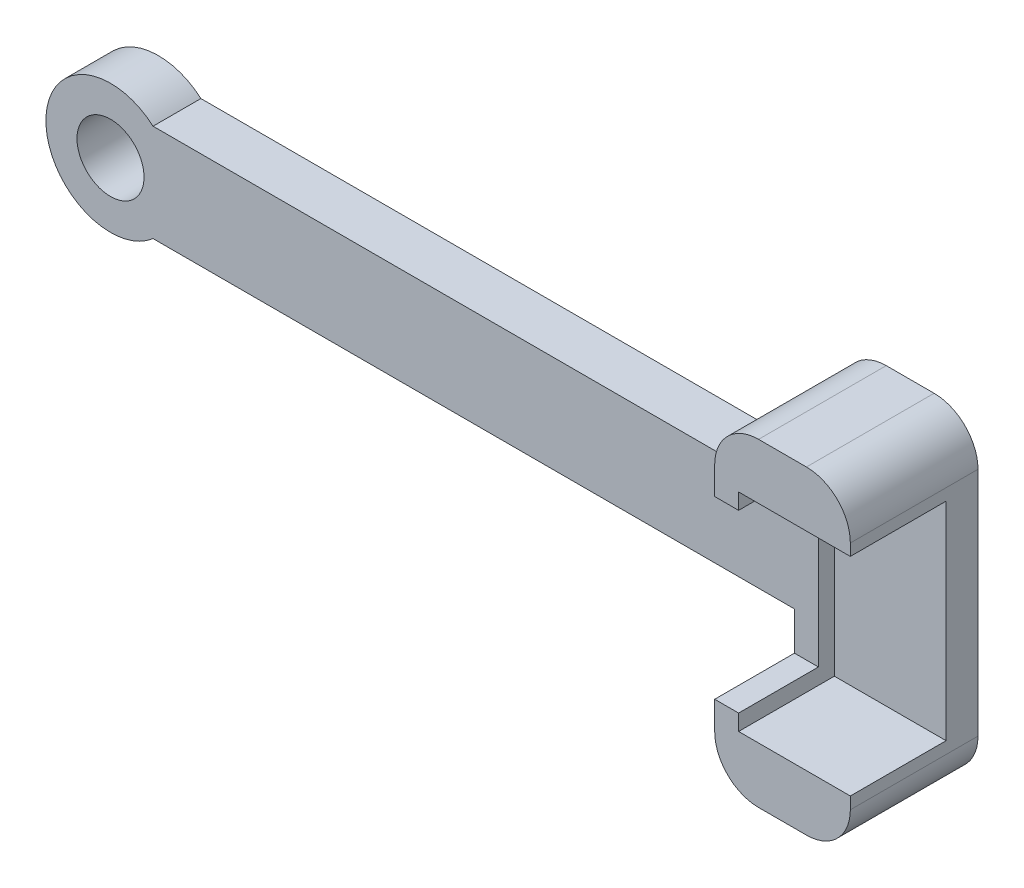
from build123d import *

# Parameters (mm, degrees)
CROQUIS5_R              = 2.552588688
SALIENTE_EXTRUIR4_DEPTH = 8
CORTAR_EXTRUIR2_START   = -5
CROQUIS6_R              = 2.552588688
CORTAR_EXTRUIR2_DEPTH   = 5
CROQUIS7_W              = 7
CROQUIS7_H              = 13
CORTAR_EXTRUIR3_DEPTH   = 6
CROQUIS8_W              = 15
CROQUIS8_H              = 30
CORTAR_EXTRUIR4_DEPTH   = 10
CROQUIS9_R              = 4.05
SALIENTE_EXTRUIR5_DEPTH = 3
CROQUIS10_R             = 2.1
CORTAR_EXTRUIR5_DEPTH   = 3


with BuildPart() as part:
    # Croquis5 → Saliente-Extruir4 (new body)
    with BuildSketch(Plane.XY):
        with BuildLine():
            Line((-12.912379316, 50.582104264), (38.083380168, 50.582104264))
            Line((38.083380168, 50.582104264), (38.083380168, 54.811507329))
            ThreePointArc((38.083380168, 54.811507329), (38.888836519, 56.756050977), (40.833380168, 57.561507329))
            Line((40.833380168, 57.561507329), (43.833380168, 57.561507329))
            ThreePointArc((43.833380168, 57.561507329), (45.777923816, 56.756050977), (46.583380168, 54.811507329))
            Line((46.583380168, 54.811507329), (46.583380168, 40.332104264))
            ThreePointArc((46.583380168, 40.332104264), (45.777923816, 38.387560616), (43.833380168, 37.582104264))
            Line((43.833380168, 37.582104264), (40.833380168, 37.582104264))
            ThreePointArc((40.833380168, 37.582104264), (38.888836519, 38.387560616), (38.083380168, 40.332104264))
            Line((38.083380168, 40.332104264), (38.083380168, 44.482104264))
            Line((38.083380168, 44.482104264), (-12.912379316, 44.482104264))
            ThreePointArc((-12.912379316, 44.482104264), (-19.776162486, 47.532104264), (-12.912379316, 50.582104264))
        make_face()
        with Locations((-15.666619832, 47.532104264)):
            Circle(CROQUIS5_R, mode=Mode.SUBTRACT)
    extrude(amount=SALIENTE_EXTRUIR4_DEPTH)

    # Croquis6 → Cortar-Extruir2 (cut)
    with BuildSketch(Plane.XY.offset(8).offset(CORTAR_EXTRUIR2_START)):
        with BuildLine():
            Line((-12.912379316, 50.582104264), (38.083380168, 50.582104264))
            Line((38.083380168, 50.582104264), (38.083380168, 53.082104264))
            Line((38.083380168, 53.082104264), (39.583380168, 53.082104264))
            Line((39.583380168, 53.082104264), (39.583380168, 42.082104264))
            Line((39.583380168, 42.082104264), (38.083380168, 42.082104264))
            Line((38.083380168, 42.082104264), (38.083380168, 44.482104264))
            Line((38.083380168, 44.482104264), (-12.912379316, 44.482104264))
            ThreePointArc((-12.912379316, 44.482104264), (-19.776162486, 47.532104264), (-12.912379316, 50.582104264))
        make_face()
        with Locations((-15.666619832, 47.532104264)):
            Circle(CROQUIS6_R, mode=Mode.SUBTRACT)
    extrude(amount=CORTAR_EXTRUIR2_DEPTH, mode=Mode.SUBTRACT)

    # Croquis7 → Cortar-Extruir3 (cut)
    with BuildSketch(Plane.XY.offset(8)):
        with Locations((43.083380168, 47.582104264)):
            Rectangle(CROQUIS7_W, CROQUIS7_H)
    extrude(amount=-CORTAR_EXTRUIR3_DEPTH, mode=Mode.SUBTRACT)

    # Croquis8 → Cortar-Extruir4 (cut)
    with BuildSketch(Plane(origin=(0, 0, 0), x_dir=(-1, 0, 0), z_dir=(0, 0, -1))):
        with Locations((12.276162486, 38.194032094)):
            Rectangle(CROQUIS8_W, CROQUIS8_H)
    extrude(amount=-CORTAR_EXTRUIR4_DEPTH, mode=Mode.SUBTRACT)

    # Croquis9 → Saliente-Extruir5 (add)
    with BuildSketch(Plane(origin=(0, 0, 0), x_dir=(-1, 0, 0), z_dir=(0, 0, -1))):
        with Locations((4.776162486, 47.532104264)):
            Circle(CROQUIS9_R)
    extrude(amount=-SALIENTE_EXTRUIR5_DEPTH)

    # Croquis10 → Cortar-Extruir5 (cut)
    with BuildSketch(Plane(origin=(0, 0, 0), x_dir=(-1, 0, 0), z_dir=(0, 0, -1))):
        with Locations((4.776162486, 47.532104264)):
            Circle(CROQUIS10_R)
    extrude(amount=-CORTAR_EXTRUIR5_DEPTH, mode=Mode.SUBTRACT)


solid = part.part
